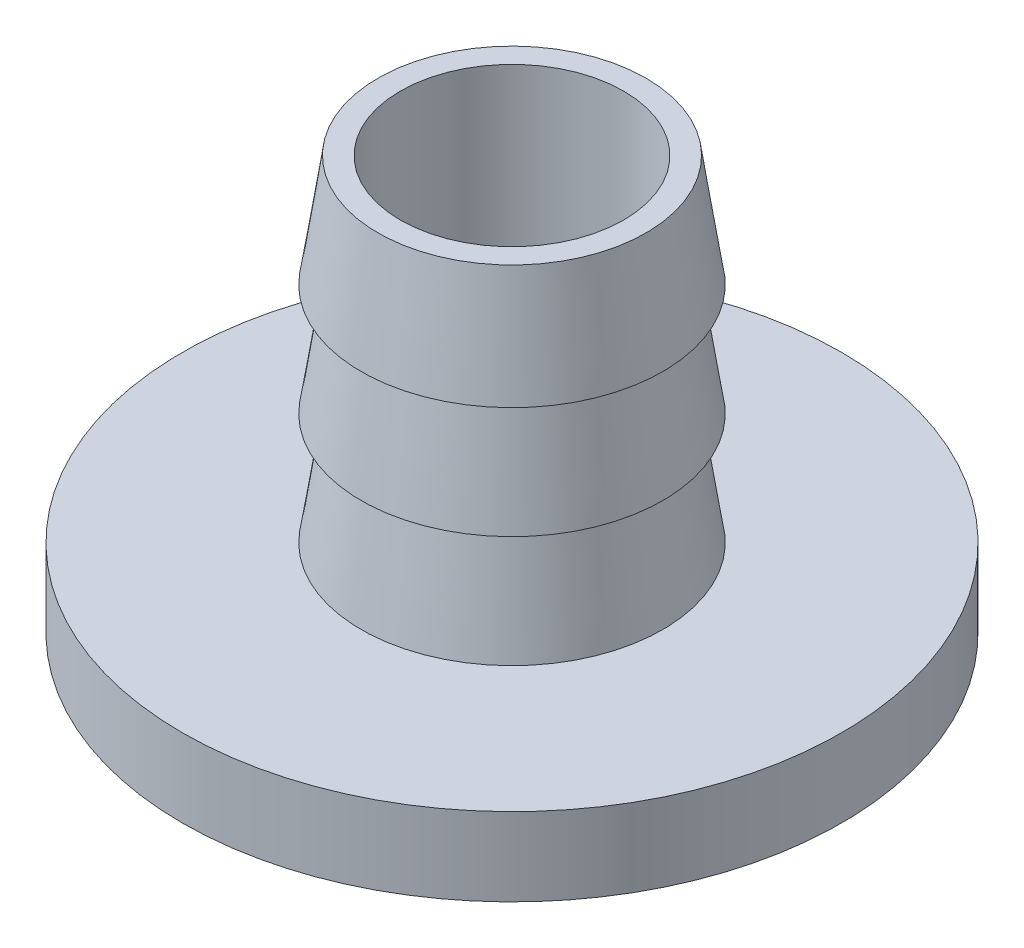
from build123d import *


with BuildPart() as part:
    # Sketch2 → Revolve1 (revolve)
    with BuildSketch(Plane.XY, mode=Mode.PRIVATE) as revolve1_sk:
        Polygon((10, 32), (10, 0), (28.5, 0), (28.5, -5), (29.5, -5), (29.5, 2), (13.5, 2), (12, 12), (13.5, 12), (12, 22), (13.5, 22), (12, 32), align=None)
    revolve(revolve1_sk.sketch.rotate(Axis((0, 0, 0), (0, 1, 0)), 90), axis=Axis((0, 0, 0), (0, 1, 0)))


solid = part.part
